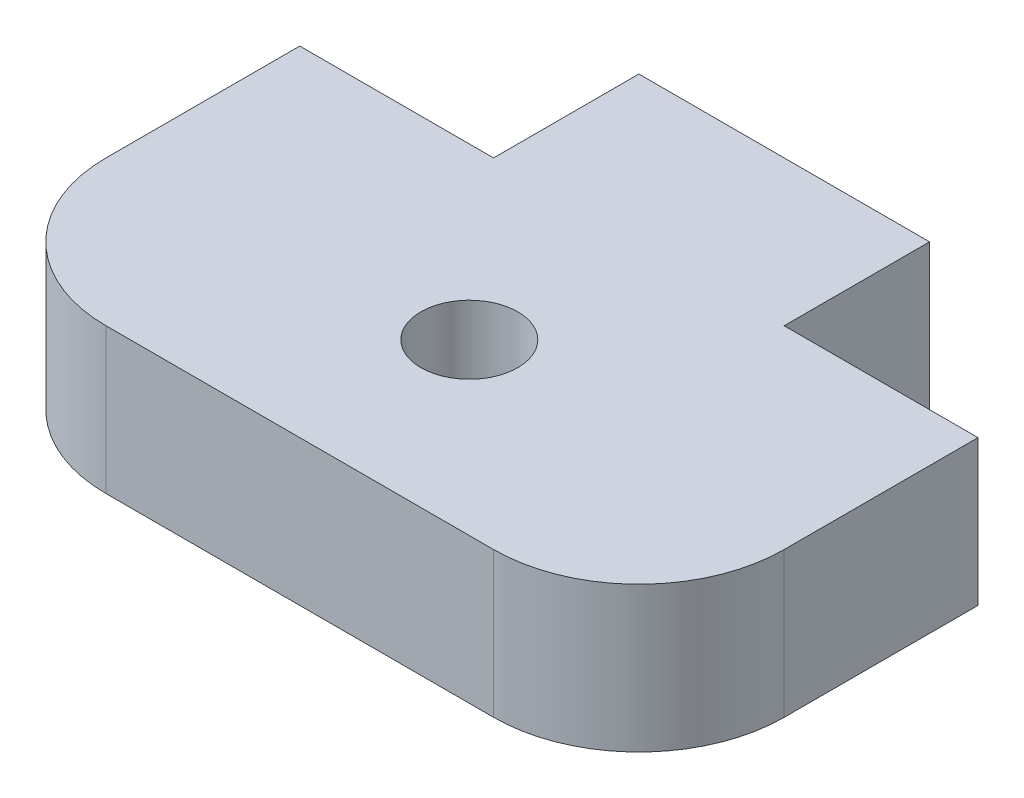
from build123d import *

# Parameters (mm, degrees)
ESQUISSE1_R        = 1
BOSS_EXTRU_1_DEPTH = 3


with BuildPart() as part:
    # Esquisse1 → Boss.-Extru.1 (new body)
    with BuildSketch(Plane(origin=(0, 0, 0), x_dir=(1, 0, 0), z_dir=(0, 1, 0))):
        with BuildLine():
            Line((-7, 7), (-3, 7))
            Line((-3, 7), (-3, 10))
            Line((-3, 10), (3, 10))
            Line((3, 10), (3, 7))
            Line((3, 7), (7, 7))
            Line((7, 7), (7, 3))
            ThreePointArc((7, 3), (6.121320344, 0.878679656), (4, 0))
            Line((4, 0), (-4, 0))
            ThreePointArc((-4, 0), (-6.121320344, 0.878679656), (-7, 3))
            Line((-7, 3), (-7, 7))
        make_face()
        with Locations(Location((0, 3.5, 0), (0, 0, 270))):
            Circle(ESQUISSE1_R, mode=Mode.SUBTRACT)
    extrude(amount=BOSS_EXTRU_1_DEPTH)


solid = part.part
